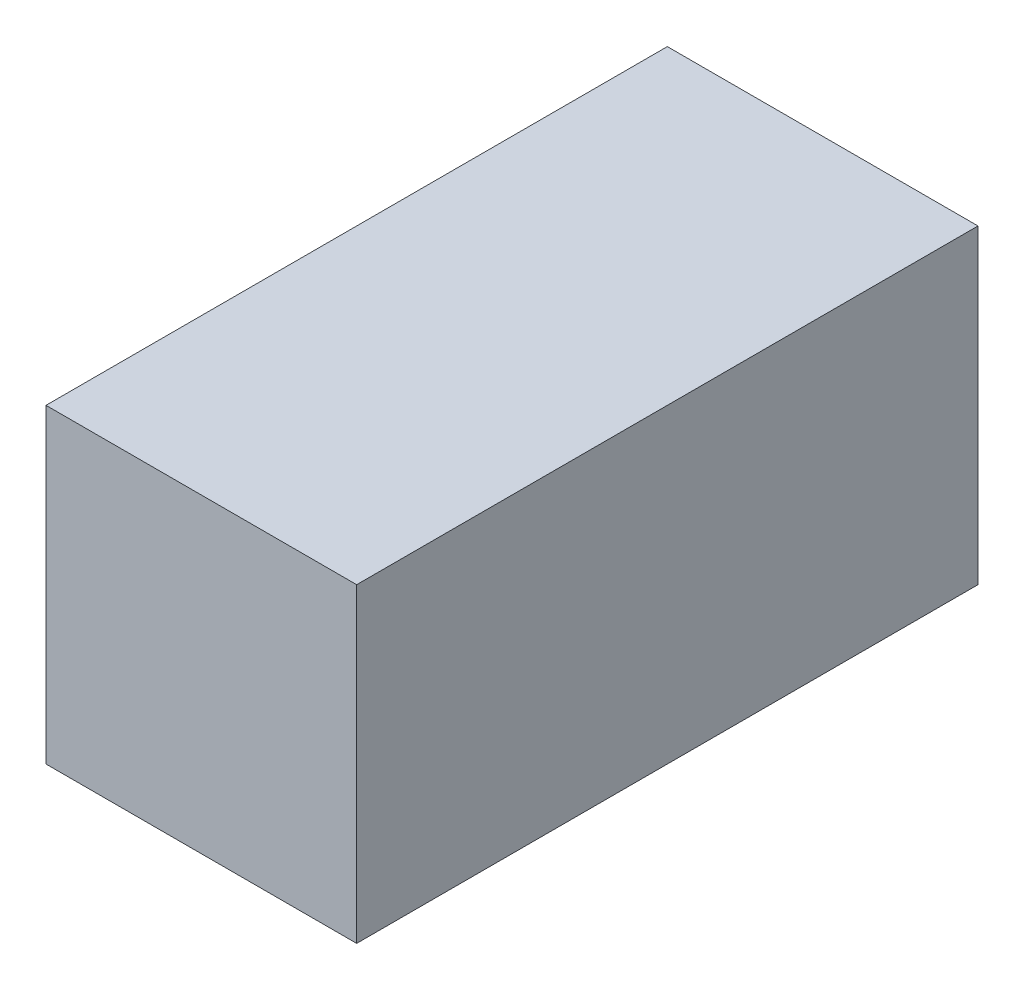
from build123d import *

# Parameters (mm, degrees)
SKETCH1_W           = 50
SKETCH1_H           = 50
BOSS_EXTRUDE1_DEPTH = 100


with BuildPart() as part:
    # Sketch1 → Boss-Extrude1 (new body)
    with BuildSketch(Plane.XY):
        with Locations((25, 25)):
            Rectangle(SKETCH1_W, SKETCH1_H)
    extrude(amount=BOSS_EXTRUDE1_DEPTH)


solid = part.part
